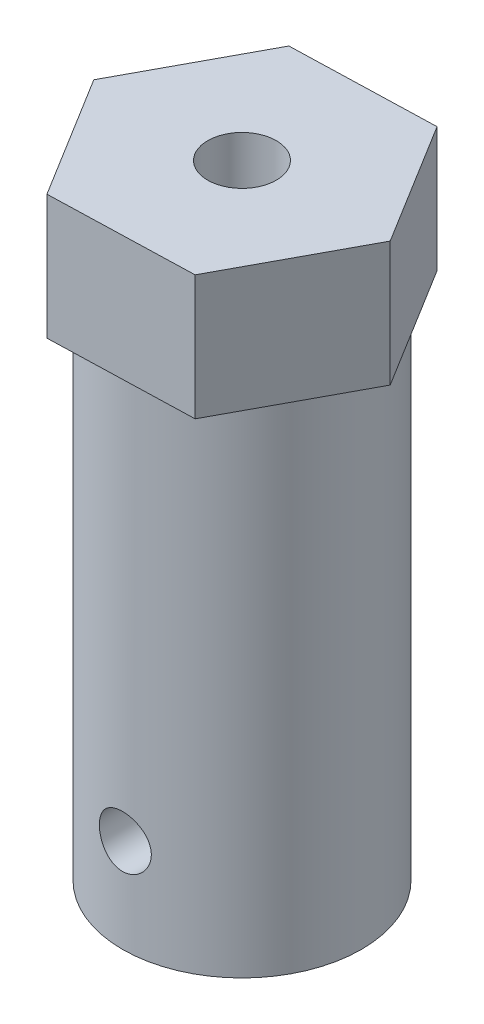
from build123d import *

# Parameters (mm, degrees)
SKETCH_1_R             = 5.75
SKETCH_1_R_2           = 3
EXTRUDE_1_DEPTH        = 24
HOLE_WIZARD_M3_1_D     = 2.5
HOLE_WIZARD_M3_1_DEPTH = 7.748924226
HOLE_WIZARD_M3_1_TIP   = 0.751075774
EXTRUDE_2_DEPTH        = 6
HOLE_WIZARD_M4_1_D     = 3.3


with BuildPart() as part:
    # 草图1 → 凸台-拉伸1 (new body)
    with BuildSketch(Plane(origin=(0, 0, 0), x_dir=(1, 0, 0), z_dir=(0, 1, 0))):
        with Locations(Location((0, 0, 0), (0, 0, 270))):
            Circle(SKETCH_1_R)
        with Locations(Location((0, 0, 0), (0, 0, 270))):
            Circle(SKETCH_1_R_2, mode=Mode.SUBTRACT)
    extrude(amount=EXTRUDE_1_DEPTH)

    # M3 螺纹孔1
    with Locations(Plane.XY.offset(5.75)):
        with Locations((0, 4.5)):
            Hole(HOLE_WIZARD_M3_1_D / 2, depth=HOLE_WIZARD_M3_1_DEPTH)
            with Locations((0, 0, -(HOLE_WIZARD_M3_1_DEPTH + HOLE_WIZARD_M3_1_TIP / 2))):  # 118° drill point
                Cone(0, HOLE_WIZARD_M3_1_D / 2, HOLE_WIZARD_M3_1_TIP, mode=Mode.SUBTRACT)

    # 草图11 → 凸台-拉伸2 (add)
    with BuildSketch(Plane(origin=(0, 24, 0), x_dir=(1, 0, 0), z_dir=(0, 1, 0))):
        Polygon((6.925181727, 0.204592398), (3.28540865, 6.0996795), (-3.639773077, 5.895087103), (-6.925181727, -0.204592398), (-3.28540865, -6.0996795), (3.639773077, -5.895087103), align=None)
    extrude(amount=EXTRUDE_2_DEPTH)

    # M4 螺纹孔的螺纹孔钻头1 (through all)
    with Locations(Plane(origin=(0, 30, 0), x_dir=(1, 0, 0), z_dir=(0, 1, 0))):
        with Locations((0, 0)):
            Hole(HOLE_WIZARD_M4_1_D / 2)


solid = part.part
